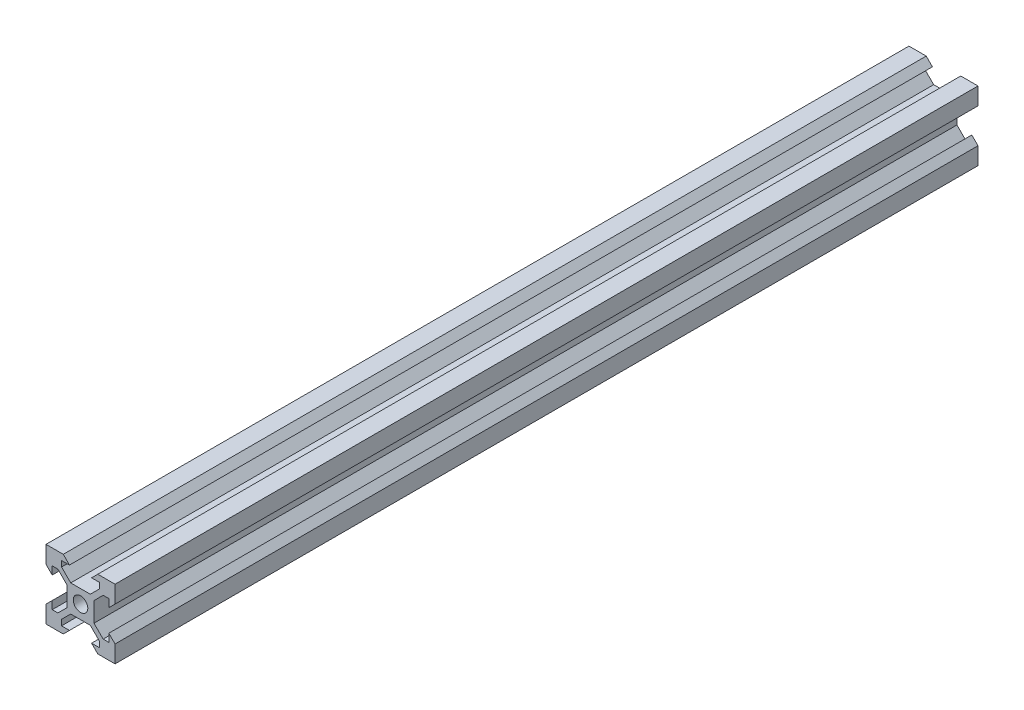
from build123d import *

# Parameters (mm, degrees)
SKETCH1_R           = 2.1
BOSS_EXTRUDE1_DEPTH = 125


with BuildPart() as part:
    # Sketch1 → Boss-Extrude1 (new, symmetric)
    with BuildSketch(Plane.XY):
        Polygon((-10, 10), (-5, 10), (-3.2, 8.2), (-5.499339828, 8.2), (-5.499339828, 6.56), (-2.84, 3.900660172), (2.84, 3.900660172), (5.499339828, 6.56), (5.499339828, 8.2), (3.2, 8.2), (5, 10), (10, 10), (10, 5), (8.2, 3.2), (8.2, 5.499339828), (6.56, 5.499339828), (3.900660172, 2.84), (3.900660172, -2.84), (6.56, -5.499339828), (8.2, -5.499339828), (8.2, -3.2), (10, -5), (10, -10), (5, -10), (3.2, -8.2), (5.499339828, -8.2), (5.499339828, -6.56), (2.84, -3.900660172), (-2.84, -3.900660172), (-5.499339828, -6.56), (-5.499339828, -8.2), (-3.2, -8.2), (-5, -10), (-10, -10), (-10, -5), (-8.2, -3.2), (-8.2, -5.499339828), (-6.56, -5.499339828), (-3.900660172, -2.84), (-3.900660172, 2.84), (-6.56, 5.499339828), (-8.2, 5.499339828), (-8.2, 3.2), (-10, 5), align=None)
        with Locations(Location((0, 0, 0), (0, 0, 180))):
            Circle(SKETCH1_R, mode=Mode.SUBTRACT)
    extrude(amount=BOSS_EXTRUDE1_DEPTH, both=True)


solid = part.part
